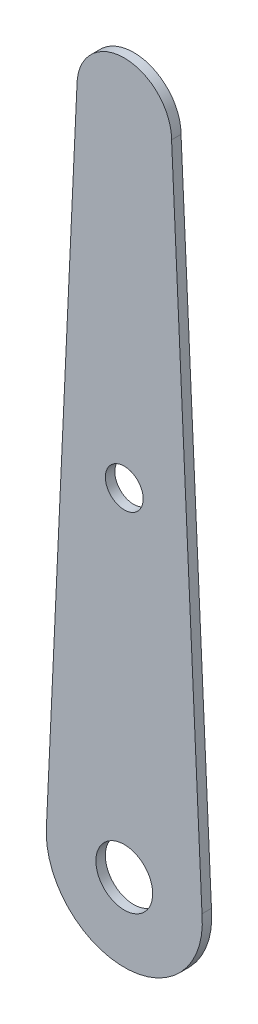
from build123d import *

# Parameters (mm, degrees)
SKETCH1_R               = 4
BOSS_EXTRUDE1_DEPTH     = 2
CUT_EXTRUDE1_DEPTH      = 121.138144992
CUT_EXTRUDE1_DEPTH_BACK = 121.138144992
SKETCH2_R               = 6


with BuildPart() as part:
    # Sketch1 → Boss-Extrude1 (new body)
    with BuildSketch(Plane.XY):
        with BuildLine():
            Line((-16.429017806, -29.488280523), (-10, 108.982872222))
            ThreePointArc((-10, 108.982872222), (0, 118.982872222), (10, 108.982872222))
            Line((10, 108.982872222), (16.429017806, -29.488280523))
            ThreePointArc((16.429017806, -29.488280523), (0, -47.517127778), (-16.429017806, -29.488280523))
        make_face()
        with Locations((0, 40.242872222)):
            Circle(SKETCH1_R, mode=Mode.SUBTRACT)
    extrude(amount=BOSS_EXTRUDE1_DEPTH)

    # Sketch2 → Cut-Extrude1 (cut, two sides: drawn at the far end of the back side and taken through both)
    with BuildSketch(Plane.XY.offset(2).offset(-CUT_EXTRUDE1_DEPTH_BACK)):
        with Locations((0, -31.017127778)):
            Circle(SKETCH2_R)
    extrude(amount=CUT_EXTRUDE1_DEPTH + CUT_EXTRUDE1_DEPTH_BACK, mode=Mode.SUBTRACT)


solid = part.part
